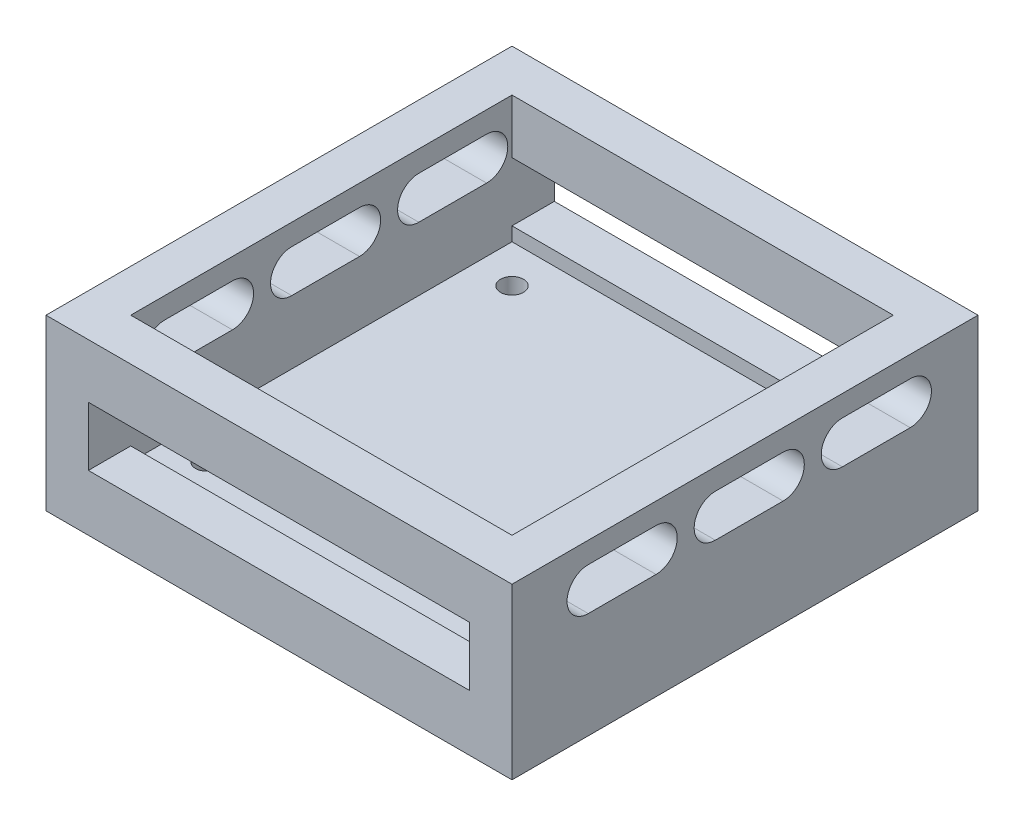
from build123d import *

# Parameters (mm, degrees)
SKETCH1_W           = 45
SKETCH1_H           = 45
SKETCH1_R           = 1.35
BOSS_EXTRUDE1_DEPTH = 5
SKETCH2_W           = 55
SKETCH2_H           = 55
SKETCH2_W_2         = 45
SKETCH2_H_2         = 45
BOSS_EXTRUDE2_DEPTH = 20
SKETCH3_W           = 45
SKETCH3_H           = 6.969851319
CUT_EXTRUDE1_DEPTH  = 65.662585782
CUT_EXTRUDE2_DEPTH  = 65.662585782
CUT_EXTRUDE3_DEPTH  = 67.801946079


with BuildPart() as part:
    # Sketch1 → Boss-Extrude1 (new body)
    with BuildSketch(Plane(origin=(0, 0, 0), x_dir=(1, 0, 0), z_dir=(0, 1, 0))):
        Rectangle(SKETCH1_W, SKETCH1_H)
        with Locations(Location((-18, 18, 0), (0, 0, 270))):
            Circle(SKETCH1_R, mode=Mode.SUBTRACT)
        with Locations(Location((18, 18, 0), (0, 0, 270))):
            Circle(SKETCH1_R, mode=Mode.SUBTRACT)
        with Locations(Location((18, -18, 0), (0, 0, 270))):
            Circle(SKETCH1_R, mode=Mode.SUBTRACT)
        with Locations(Location((-18, -18, 0), (0, 0, 270))):
            Circle(SKETCH1_R, mode=Mode.SUBTRACT)
    extrude(amount=BOSS_EXTRUDE1_DEPTH)

    # Sketch2 → Boss-Extrude2 (add)
    with BuildSketch(Plane(origin=(0, 0, 0), x_dir=(1, 0, 0), z_dir=(0, 1, 0))):
        Rectangle(SKETCH2_W, SKETCH2_H)
        Rectangle(SKETCH2_W_2, SKETCH2_H_2, mode=Mode.SUBTRACT)
    extrude(amount=BOSS_EXTRUDE2_DEPTH)

    # Sketch3 → Cut-Extrude1 (cut, through all)
    with BuildSketch(Plane(origin=(0, 0, -27.5), x_dir=(-1, 0, 0), z_dir=(0, 0, -1))):
        with Locations((0, 10.115904606)):
            Rectangle(SKETCH3_W, SKETCH3_H)
    extrude(amount=-CUT_EXTRUDE1_DEPTH, mode=Mode.SUBTRACT)

    # Sketch4 → Cut-Extrude2 (cut, through all)
    with BuildSketch(Plane.ZY.offset(27.5)):
        with BuildLine():
            Line((-11.5, 12.5), (-19.5, 12.5))
            ThreePointArc((-19.5, 12.5), (-22, 15), (-19.5, 17.5))
            Line((-19.5, 17.5), (-11.5, 17.5))
            ThreePointArc((-11.5, 17.5), (-9, 15), (-11.5, 12.5))
        make_face()
        with BuildLine():
            Line((3.5, 17.5), (-4.5, 17.5))
            ThreePointArc((-4.5, 17.5), (-7, 15), (-4.5, 12.5))
            Line((-4.5, 12.5), (3.5, 12.5))
            ThreePointArc((3.5, 12.5), (6, 15), (3.5, 17.5))
        make_face()
        with BuildLine():
            Line((18.5, 17.5), (10.5, 17.5))
            ThreePointArc((10.5, 17.5), (8, 15), (10.5, 12.5))
            Line((10.5, 12.5), (18.5, 12.5))
            ThreePointArc((18.5, 12.5), (21, 15), (18.5, 17.5))
        make_face()
    extrude(amount=-CUT_EXTRUDE2_DEPTH, mode=Mode.SUBTRACT)

    # Sketch5 → Cut-Extrude3 (cut, through all)
    with BuildSketch(Plane(origin=(0, 0, -30), x_dir=(-1, 0, 0), z_dir=(0, 0, -1))):
        with BuildLine():
            Line((-7.5, 33), (7.5, 33))
            ThreePointArc((7.5, 33), (10.5, 30), (7.5, 27))
            Line((7.5, 27), (-7.5, 27))
            ThreePointArc((-7.5, 27), (-10.5, 30), (-7.5, 33))
        make_face()
    extrude(amount=-CUT_EXTRUDE3_DEPTH, mode=Mode.SUBTRACT)


solid = part.part
